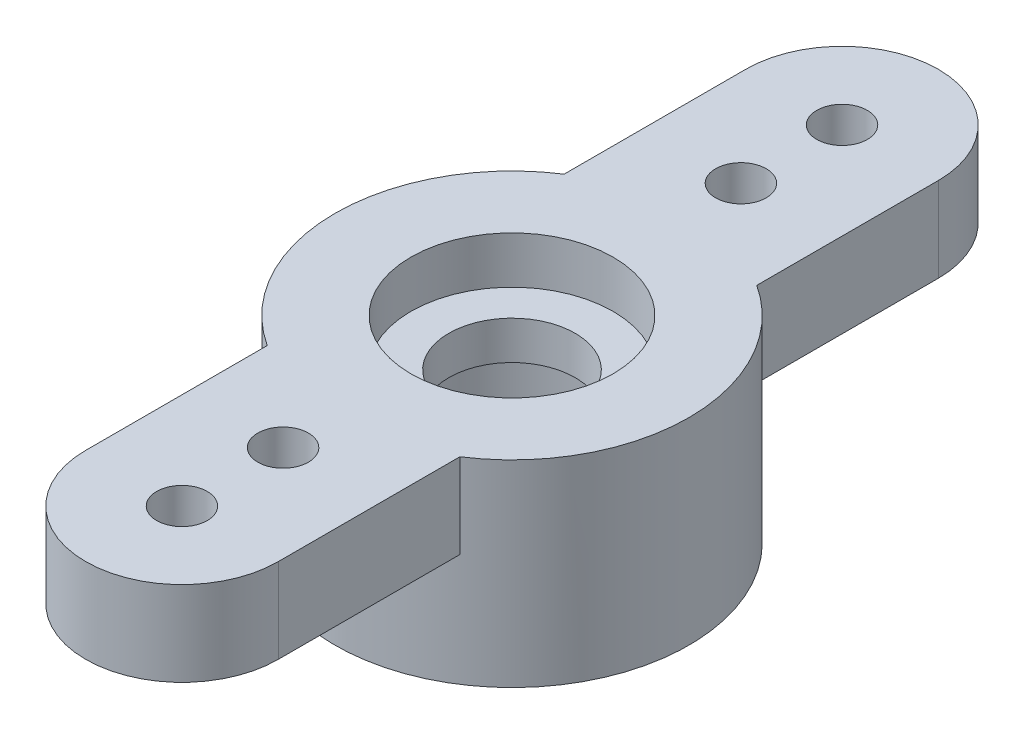
from build123d import *

# Parameters (mm, degrees)
BOSS_EXTRUDE1_START = -1.675
SKETCH2_R           = 0.5
BOSS_EXTRUDE1_DEPTH = 1.675
CIRPATTERN1_COUNT   = 2


with BuildPart() as part:
    # Sketch1 → Revolve1 (revolve)
    with BuildSketch(Plane.XY, mode=Mode.PRIVATE) as revolve1_sk:
        Polygon((2.25, 0), (1.25, 0), (1.25, 0.76), (2, 0.76), (2, 1.69), (3.5, 1.69), (3.5, -2.21), (2.25, -2.21), align=None)
    revolve(revolve1_sk.sketch.rotate(Axis((0, 0, 0), (0, -1, 0)), 180), axis=Axis((0, 0, 0), (0, -1, 0)))

    # Sketch2 → Boss-Extrude1 (add)
    with BuildSketch(Plane(origin=(0, 1.69, 0), x_dir=(1, 0, 0), z_dir=(0, 1, 0)).offset(BOSS_EXTRUDE1_START)):
        with BuildLine():
            Line((-1.905, 6.5278), (-1.905, 2.93614969))
            ThreePointArc((-1.905, 2.93614969), (0, 3.5), (1.905, 2.93614969))
            Line((1.905, 2.93614969), (1.905, 6.5278))
            ThreePointArc((1.905, 6.5278), (0, 8.4328), (-1.905, 6.5278))
        make_face()
        with Locations(Location((0, 6.5278, 0), (0, 0, 180))):
            Circle(SKETCH2_R, mode=Mode.SUBTRACT)
        with Locations(Location((0, 4.5278, 0), (0, 0, 180))):
            Circle(SKETCH2_R, mode=Mode.SUBTRACT)
    boss_extrude1 = extrude(amount=BOSS_EXTRUDE1_DEPTH)

    # CirPattern1: Boss-Extrude1 ×2 about axis
    cirpattern1_axis = Axis((0, 0, 0), (0, 1, 0))
    for i in range(1, CIRPATTERN1_COUNT):
        add(boss_extrude1.rotate(cirpattern1_axis, i * 360 / CIRPATTERN1_COUNT))


solid = part.part
